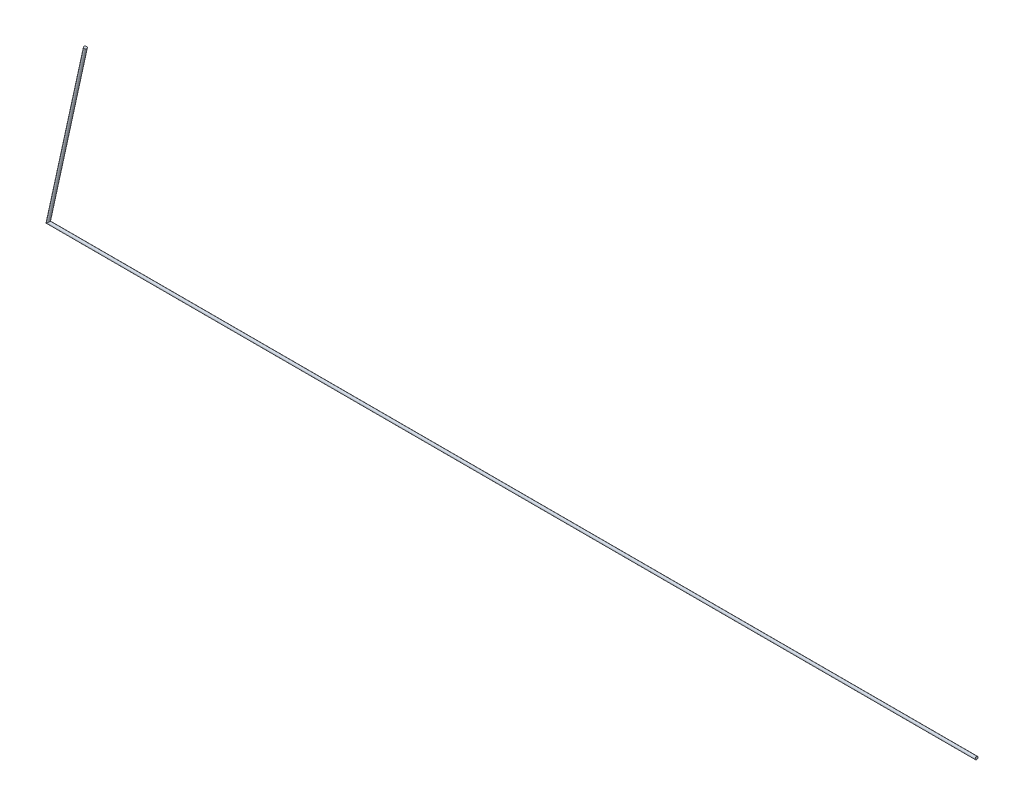
from build123d import *

# Parameters (mm, degrees)
SKETCH2_R = 0.1905


with BuildPart() as part:
    # Sweep1: sweep along a path in Sketch1
    with BuildLine(Plane.XY) as sweep1_path:
        Line((0, 0), (-125, 0))
        Line((-125, 0), (-120, 22.86))
    # Sketch2 → Sweep1 (sweep)
    with BuildSketch(Plane(origin=(0, 0, 0), x_dir=(0, 0, -1), z_dir=(1, 0, 0))):
        Circle(SKETCH2_R)
    sweep(path=sweep1_path.line, transition=Transition.RIGHT)


solid = part.part
